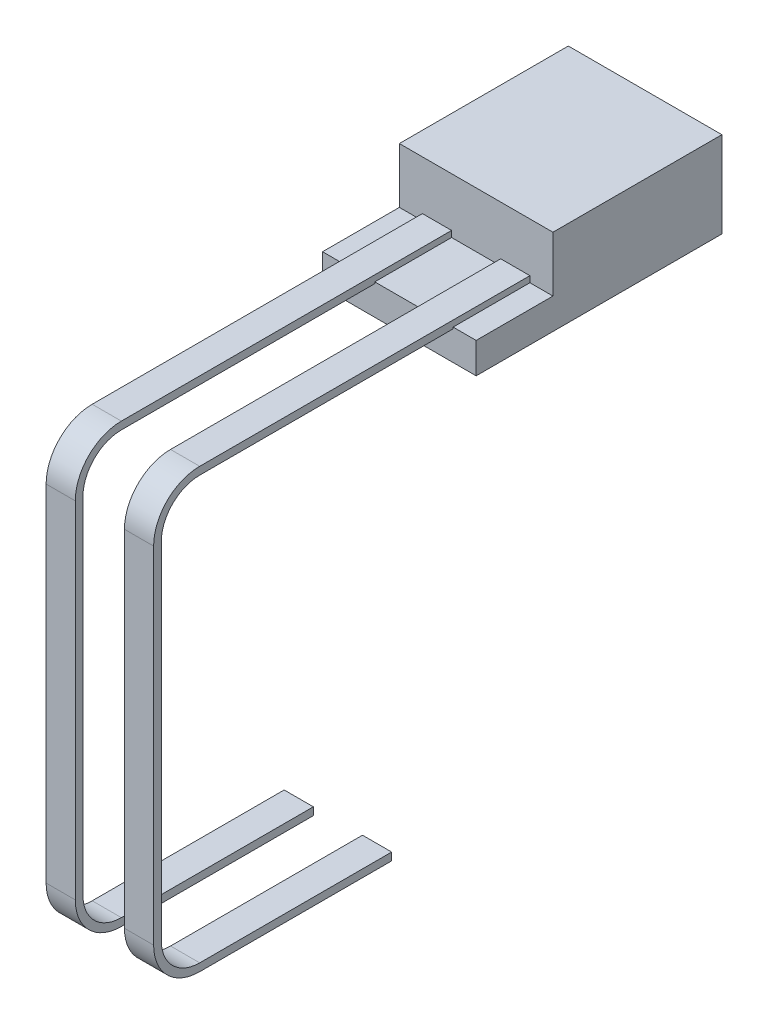
from build123d import *

# Parameters (mm, degrees)
SKETCH1_W           = 2
SKETCH1_H           = 3.2
BOSS_EXTRUDE1_DEPTH = 1.12
SKETCH2_W           = 1.433816818
SKETCH2_H           = 1.065005429
CUT_EXTRUDE1_DEPTH  = 5
SKETCH3_W           = 0.38
SKETCH3_H           = 0.1


with BuildPart() as part:
    # Sketch1 → Boss-Extrude1 (new body)
    with BuildSketch(Plane(origin=(0, 0, 0), x_dir=(1, 0, 0), z_dir=(0, 1, 0))):
        with Locations((0, -1.6)):
            Rectangle(SKETCH1_W, SKETCH1_H)
    extrude(amount=BOSS_EXTRUDE1_DEPTH)

    # Sketch2 → Cut-Extrude1 (cut, symmetric)
    with BuildSketch(Plane(origin=(0, 0, 0), x_dir=(0, 0, -1), z_dir=(1, 0, 0))):
        with Locations((-2.916908409, 0.932502714)):
            Rectangle(SKETCH2_W, SKETCH2_H)
    extrude(amount=CUT_EXTRUDE1_DEPTH, both=True, mode=Mode.SUBTRACT)

    # Sweep1: sweep along a curve in space
    with BuildLine() as sweep1_path:
        Line((0.51, 0.38, 2.2), (0.51, 0.38, 6.5))
        ThreePointArc((0.51, 0.38, 6.5), (0.51, 0.233553391, 6.853553391), (0.51, -0.12, 7))
        Line((0.51, -0.12, 7), (0.51, -4.62, 7))
        ThreePointArc((0.51, -4.62, 7), (0.51, -4.973553391, 6.853553391), (0.51, -5.12, 6.5))
        Line((0.51, -5.12, 6.5), (0.51, -5.12, 4))
    # Sketch3 → Sweep1 (sweep)
    with BuildSketch(Plane.XY.offset(2.2)):
        with Locations((0.51, 0.43)):
            Rectangle(SKETCH3_W, SKETCH3_H)
    sweep1 = sweep(path=sweep1_path.line)

    # Mirror1: Sweep1 across plane
    add(sweep1.mirror(Plane(origin=(0, 0, 0), x_dir=(0, 0, 1), z_dir=(1, 0, 0))))


solid = part.part
